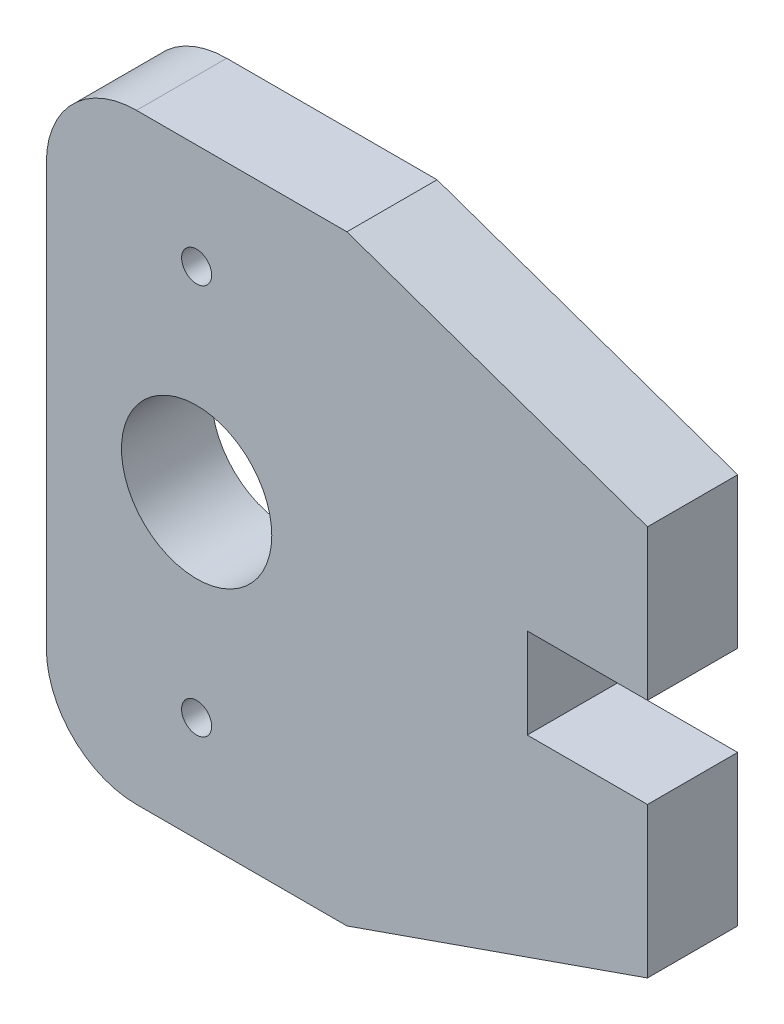
from build123d import *

# Parameters (mm, degrees)
SKETCH1_R           = 0.5
BOSS_EXTRUDE1_DEPTH = 3
FILLET1_R           = 3
SKETCH2_R           = 2.5
CUT_EXTRUDE1_DEPTH  = 3


with BuildPart() as part:
    # Sketch1 → Boss-Extrude1 (new body)
    with BuildSketch(Plane.XY):
        Polygon((-10, 10), (0, 10), (10, 6.5), (10, 1.5), (6, 1.5), (6, -1.5), (10, -1.5), (10, -6.5), (0, -10), (-10, -10), align=None)
        with Locations((-5, 6.5)):
            Circle(SKETCH1_R, mode=Mode.SUBTRACT)
        with Locations((-5, -6.5)):
            Circle(SKETCH1_R, mode=Mode.SUBTRACT)
    extrude(amount=BOSS_EXTRUDE1_DEPTH)

    # Fillet1
    fillet1_edges = [part.edges().sort_by_distance(p)[0] for p in [
        (-10, 10, 1.5),
        (-10, -10, 1.5),
    ]]
    fillet(fillet1_edges, radius=FILLET1_R)

    # Sketch2 → Cut-Extrude1 (cut)
    with BuildSketch(Plane.XY.offset(3)):
        with Locations((-5, 0)):
            Circle(SKETCH2_R)
    extrude(amount=-CUT_EXTRUDE1_DEPTH, mode=Mode.SUBTRACT)


solid = part.part
